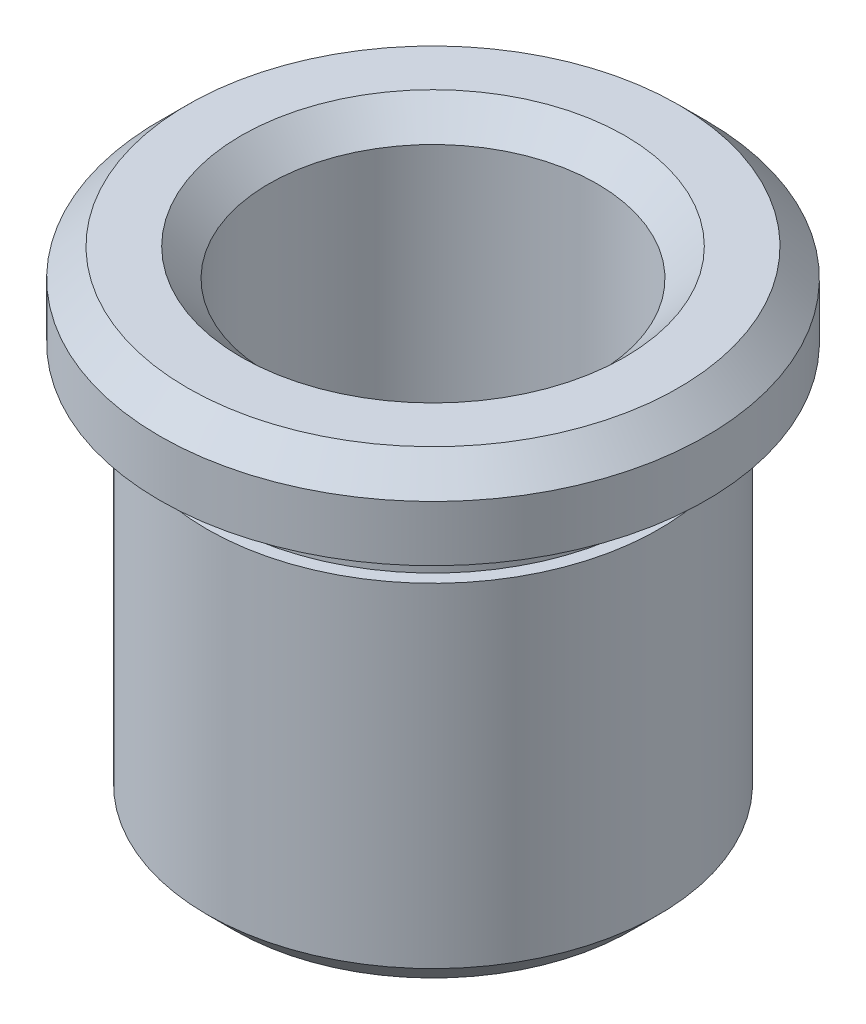
from build123d import *


with BuildPart() as part:
    # Sketch1 → Revolve1 (revolve)
    with BuildSketch(Plane.XY, mode=Mode.PRIVATE) as revolve1_sk:
        Polygon((1.4224, 0), (3.6195, 0), (4.1275, 0.508), (4.1275, 6.604), (3.8989, 6.604), (3.8989, 7.493), (4.9911, 7.493), (4.9911, 8.509), (4.4831, 9.017), (3.5052, 9.017), (2.9972, 8.509), (2.9972, 2.134510809), (2.197467426, 1.334778236), (1.4224, 1.334778236), align=None)
    revolve(revolve1_sk.sketch.rotate(Axis((0, 0, 0), (0, 1, 0)), 90), axis=Axis((0, 0, 0), (0, 1, 0)))


solid = part.part
